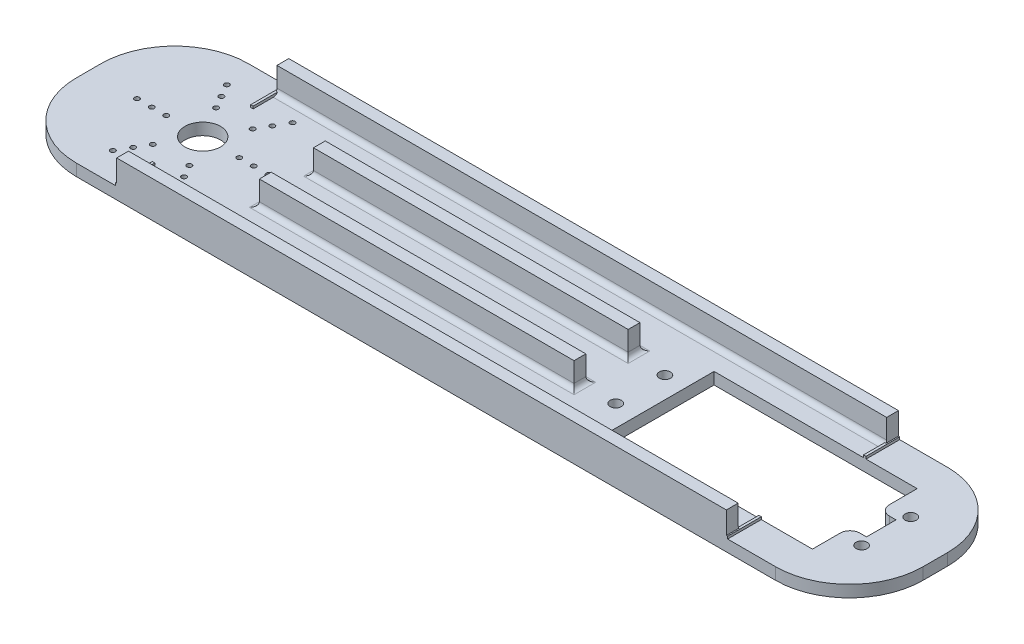
from build123d import *

# Parameters (mm, degrees)
SKETCH1_W               = 172.2
SKETCH1_H               = 35
BOSS_EXTRUDE1_DEPTH     = 2.4
SKETCH2_R               = 1.13
SKETCH2_R_2             = 3.625
SKETCH2_R_3             = 0.5
SKETCH2_W               = 40
SKETCH2_H               = 20
CUT_EXTRUDE1_DEPTH      = 2.4
SKETCH4_W               = 4
SKETCH4_H               = 6
CUT_EXTRUDE2_DEPTH      = 2.4
SKETCH5_W               = 0.5
SKETCH5_H               = 7.5
BOSS_EXTRUDE2_DEPTH     = 0.5
CUT_EXTRUDE3_DEPTH      = 134.373649476
CUT_EXTRUDE3_DEPTH_BACK = 134.373649476
SKETCH7_W               = 41.3
SKETCH7_H               = 21.3
SKETCH7_W_2             = 40
SKETCH7_H_2             = 20
SKETCH8_W               = 124
SKETCH8_H               = 2.4
SKETCH8_W_2             = 64
BOSS_EXTRUDE3_DEPTH     = 5
FILLET1_R               = 15
FILLET2_R               = 2
FILLET3_R               = 1


with BuildPart() as part:
    # Sketch1 → Boss-Extrude1 (new body)
    with BuildSketch(Plane(origin=(0, 0, 0), x_dir=(1, 0, 0), z_dir=(0, 1, 0))):
        with Locations((41.422946176, 21.495750708)):
            Rectangle(SKETCH1_W, SKETCH1_H)
    extrude(amount=BOSS_EXTRUDE1_DEPTH)

    # Sketch2 → Cut-Extrude1 (cut)
    with BuildSketch(Plane(origin=(0, 2.4, 0), x_dir=(1, 0, 0), z_dir=(0, 1, 0))):
        with Locations(Location((67.522946176, 26.495750708, 0), (0, 0, 270))):
            Circle(SKETCH2_R)
        with Locations(Location((117.522946176, 26.495750708, 0), (0, 0, 270))):
            Circle(SKETCH2_R)
        with Locations(Location((117.522946176, 16.495750708, 0), (0, 0, 90))):
            Circle(SKETCH2_R)
        with Locations(Location((67.522946176, 16.495750708, 0), (0, 0, 90))):
            Circle(SKETCH2_R)
        with Locations(Location((-21.477053824, 21.495750708, 0), (0, 0, 270))):
            Circle(SKETCH2_R_2)
        with Locations(Location((-28.907053824, 21.495750708, 0), (0, 0, 270))):
            Circle(SKETCH2_R_3)
        with Locations(Location((-31.842053824, 21.495750708, 0), (0, 0, 270))):
            Circle(SKETCH2_R_3)
        with Locations(Location((-34.847053824, 21.495750708, 0), (0, 0, 270))):
            Circle(SKETCH2_R_3)
        with Locations(Location((-25.192053824, 27.930319458, 0), (0, 0, 270))):
            Circle(SKETCH2_R_3)
        with Locations(Location((-28.162053824, 33.074510357, 0), (0, 0, 270))):
            Circle(SKETCH2_R_3)
        with Locations(Location((-26.659553824, 30.472104018, 0), (0, 0, 270))):
            Circle(SKETCH2_R_3)
        with Locations(Location((-17.762053824, 27.930319458, 0), (0, 0, 270))):
            Circle(SKETCH2_R_3)
        with Locations(Location((-14.792053824, 33.074510357, 0), (0, 0, 270))):
            Circle(SKETCH2_R_3)
        with Locations(Location((-16.294553824, 30.472104018, 0), (0, 0, 270))):
            Circle(SKETCH2_R_3)
        with Locations(Location((-14.047053824, 21.495750708, 0), (0, 0, 270))):
            Circle(SKETCH2_R_3)
        with Locations(Location((-8.107053824, 21.495750708, 0), (0, 0, 270))):
            Circle(SKETCH2_R_3)
        with Locations(Location((-11.112053824, 21.495750708, 0), (0, 0, 270))):
            Circle(SKETCH2_R_3)
        with Locations(Location((-17.762053824, 15.061181958, 0), (0, 0, 270))):
            Circle(SKETCH2_R_3)
        with Locations(Location((-14.792053824, 9.91699106, 0), (0, 0, 270))):
            Circle(SKETCH2_R_3)
        with Locations(Location((-16.294553824, 12.519397398, 0), (0, 0, 270))):
            Circle(SKETCH2_R_3)
        with Locations(Location((-25.192053824, 15.061181958, 0), (0, 0, 270))):
            Circle(SKETCH2_R_3)
        with Locations(Location((-28.162053824, 9.91699106, 0), (0, 0, 270))):
            Circle(SKETCH2_R_3)
        with Locations(Location((-26.659553824, 12.519397398, 0), (0, 0, 270))):
            Circle(SKETCH2_R_3)
        with Locations((92.522946176, 21.495750708)):
            Rectangle(SKETCH2_W, SKETCH2_H)
    extrude(amount=-CUT_EXTRUDE1_DEPTH, mode=Mode.SUBTRACT)

    # Sketch4 → Cut-Extrude2 (cut)
    with BuildSketch(Plane(origin=(0, 2.4, 0), x_dir=(1, 0, 0), z_dir=(0, 1, 0))):
        with Locations((114.522946176, 21.495750708)):
            Rectangle(SKETCH4_W, SKETCH4_H)
    extrude(amount=-CUT_EXTRUDE2_DEPTH, mode=Mode.SUBTRACT)

    # Sketch5 → Boss-Extrude2 (add)
    with BuildSketch(Plane(origin=(0, 2.4, 0), x_dir=(1, 0, 0), z_dir=(0, 1, 0))):
        with Locations((102.522946176, 35.245750708)):
            Rectangle(SKETCH5_W, SKETCH5_H)
        with Locations((102.522946176, 7.745750708)):
            Rectangle(SKETCH5_W, SKETCH5_H)
        with Locations((-21.477053824, 7.745750708)):
            Rectangle(SKETCH5_W, SKETCH5_H)
        with Locations((-21.477053824, 35.245750708)):
            Rectangle(SKETCH5_W, SKETCH5_H)
    extrude(amount=BOSS_EXTRUDE2_DEPTH)

    # Sketch7 → Cut-Extrude3 (cut, two sides: drawn at the far end of the back side and taken through both)
    with BuildSketch(Plane(origin=(0, 2.4, 0), x_dir=(1, 0, 0), z_dir=(0, 1, 0)).offset(-CUT_EXTRUDE3_DEPTH_BACK)):
        with Locations((92.522946176, 21.495750708)):
            Rectangle(SKETCH7_W, SKETCH7_H)
        with Locations((92.522946176, 21.495750708)):
            Rectangle(SKETCH7_W_2, SKETCH7_H_2, mode=Mode.SUBTRACT)
    extrude(amount=CUT_EXTRUDE3_DEPTH + CUT_EXTRUDE3_DEPTH_BACK, mode=Mode.SUBTRACT)

    # Sketch8 → Boss-Extrude3 (add)
    with BuildSketch(Plane(origin=(0, 2.4, 0), x_dir=(1, 0, 0), z_dir=(0, 1, 0))):
        with Locations((40.522946176, 37.795750708)):
            Rectangle(SKETCH8_W, SKETCH8_H)
        with Locations((28.743410163, 26.995750708)):
            Rectangle(SKETCH8_W_2, SKETCH8_H)
        with Locations((28.743410163, 15.995750708)):
            Rectangle(SKETCH8_W_2, SKETCH8_H)
        with Locations((40.522946176, 5.195750708)):
            Rectangle(SKETCH8_W, SKETCH8_H)
    extrude(amount=BOSS_EXTRUDE3_DEPTH)

    # Fillet1
    fillet1_edges = [part.edges().sort_by_distance(p)[0] for p in [
        (-44.677053824, 1.2, -38.995750708),
        (127.522946176, 1.2, -38.995750708),
        (127.522946176, 1.2, -3.995750708),
        (-44.677053824, 1.2, -3.995750708),
    ]]
    fillet(fillet1_edges, radius=FILLET1_R)

    # Fillet2
    fillet2_edges = [part.edges().sort_by_distance(p)[0] for p in [
        (113.172946176, 1.2, -18.495750708),
        (113.172946176, 1.2, -24.495750708),
    ]]
    fillet(fillet2_edges, radius=FILLET2_R)

    # Fillet3
    fillet3_edges = [part.edges().sort_by_distance(p)[0] for p in [
        (40.522946176, 2.4, -6.395750708),
        (60.743410163, 2.4, -15.995750708),
        (28.743410163, 2.4, -17.195750708),
        (60.743410163, 2.4, -26.995750708),
        (28.743410163, 2.4, -28.195750708),
        (28.743410163, 2.4, -14.795750708),
        (-3.256589837, 2.4, -15.995750708),
        (-3.256589837, 2.4, -26.995750708),
        (28.743410163, 2.4, -25.795750708),
        (40.522946176, 2.4, -36.595750708),
    ]]
    fillet(fillet3_edges, radius=FILLET3_R)


solid = part.part
